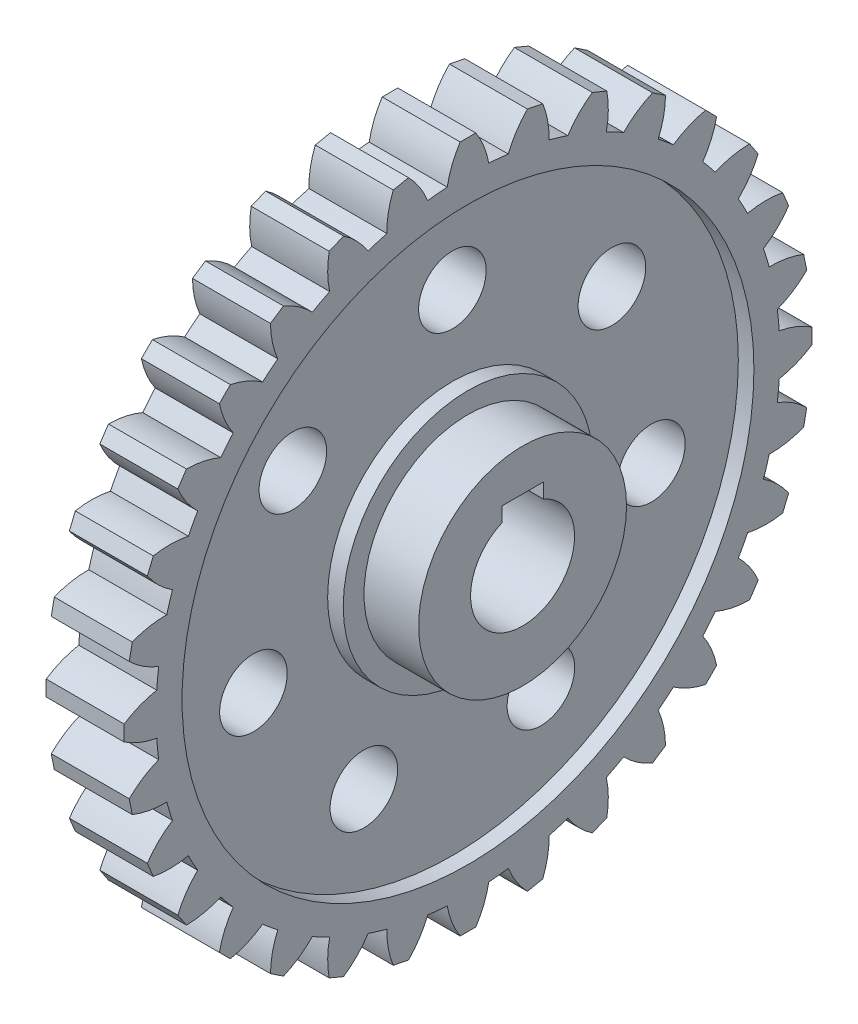
from build123d import *

# Parameters (mm, degrees)
SKETCH1_R           = 60
BOSS_EXTRUDE1_DEPTH = 7.5
BOSS_EXTRUDE2_DEPTH = 15
CIRPATTERN1_COUNT   = 32
SKETCH4_R           = 20
BOSS_EXTRUDE4_DEPTH = 18
CUT_EXTRUDE1_DEPTH  = 101.220148055
SKETCH6_R           = 55
SKETCH6_R_2         = 24
CUT_EXTRUDE2_DEPTH  = 3
SKETCH7_R           = 6.5
CUT_EXTRUDE3_DEPTH  = 97.199418274


with BuildPart() as part:
    # Sketch1 → Boss-Extrude1 (new, symmetric)
    with BuildSketch(Plane(origin=(0, 0, 0), x_dir=(0, 0, -1), z_dir=(1, 0, 0))):
        Circle(SKETCH1_R)
    extrude(amount=BOSS_EXTRUDE1_DEPTH, both=True)

    # Sketch2 → Boss-Extrude2 (add)
    with BuildSketch(Plane(origin=(7.5, 0, 0), x_dir=(0, 0, -1), z_dir=(1, 0, 0))):
        with BuildLine():
            Line((-1.5, 66.136518188), (1.5, 66.136518188))
            ThreePointArc((1.5, 66.136518188), (3.064324573, 63.126846965), (4, 59.866518188))
            ThreePointArc((4, 59.866518188), (0, -60), (-4, 59.866518188))
            ThreePointArc((-4, 59.866518188), (-3.064324573, 63.126846965), (-1.5, 66.136518188))
        make_face()
    boss_extrude2 = extrude(amount=-BOSS_EXTRUDE2_DEPTH)

    # CirPattern1: Boss-Extrude2 ×32 about axis
    cirpattern1_axis = Axis((0, 0, 0), (1, 0, 0))
    for i in range(1, CIRPATTERN1_COUNT):
        add(boss_extrude2.rotate(cirpattern1_axis, i * 360 / CIRPATTERN1_COUNT))

    # Sketch4 → Boss-Extrude4 (add, symmetric)
    with BuildSketch(Plane(origin=(0, 0, 0), x_dir=(0, 0, -1), z_dir=(1, 0, 0))):
        Circle(SKETCH4_R)
    extrude(amount=BOSS_EXTRUDE4_DEPTH, both=True)

    # Sketch5 → Cut-Extrude1 (cut, through all)
    with BuildSketch(Plane(origin=(18, 0, 0), x_dir=(0, 0, -1), z_dir=(1, 0, 0))):
        with BuildLine():
            Line((-4, 12), (4, 12))
            Line((4, 12), (4, 9.16515139))
            ThreePointArc((4, 9.16515139), (0, -10), (-4, 9.16515139))
            Line((-4, 9.16515139), (-4, 12))
        make_face()
    extrude(amount=-CUT_EXTRUDE1_DEPTH, mode=Mode.SUBTRACT)

    # Sketch6 → Cut-Extrude2 (cut)
    with BuildSketch(Plane(origin=(7.5, 0, 0), x_dir=(0, 0, -1), z_dir=(1, 0, 0))):
        Circle(SKETCH6_R)
        Circle(SKETCH6_R_2, mode=Mode.SUBTRACT)
    extrude(amount=-CUT_EXTRUDE2_DEPTH, mode=Mode.SUBTRACT)

    # Sketch7 → Cut-Extrude3 (cut, through all)
    with BuildSketch(Plane(origin=(4.5, 0, 0), x_dir=(0, 0, -1), z_dir=(1, 0, 0))):
        with Locations((0, 39.25)):
            Circle(SKETCH7_R)
        with Locations((30.686885687, 24.471974723)):
            Circle(SKETCH7_R)
        with Locations((38.265920553, -8.733946658)):
            Circle(SKETCH7_R)
        with Locations((17.02993676, -35.363028065)):
            Circle(SKETCH7_R)
        with Locations((-17.02993676, -35.363028065)):
            Circle(SKETCH7_R)
        with Locations((-38.265920553, -8.733946658)):
            Circle(SKETCH7_R)
        with Locations((-30.686885687, 24.471974723)):
            Circle(SKETCH7_R)
    extrude(amount=-CUT_EXTRUDE3_DEPTH, mode=Mode.SUBTRACT)


solid = part.part
